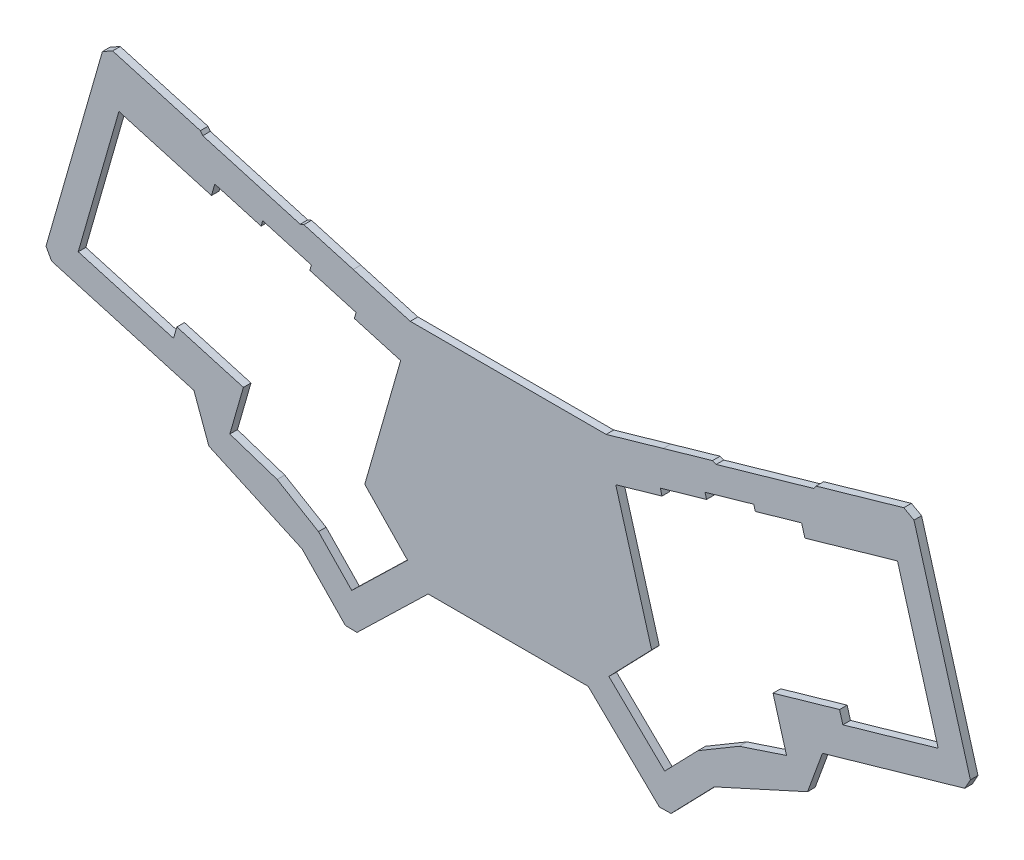
from build123d import *

# Parameters (mm, degrees)
BOSS_EXTRU_1_DEPTH = 3


with BuildPart() as part:
    # Esquisse1 → Boss.-Extru.1 (new body)
    with BuildSketch(Plane.XY):
        Polygon((-113.35310374, -10.173637327), (-129.143746737, -14.701531345), (-206.446773007, -14.701531345), (-222.237416003, -10.173637327), (-228.962816583, -8.245159743), (-248.413999189, -2.668793647), (-249.872259625, -3.248768002), (-288.323340616, 7.774587685), (-289.252816682, 9.039090747), (-323.901077775, 18.972234266), (-327.912092601, 16.748746626), (-350.173506381, -60.88602933), (-347.950273, -64.896848521), (-291.80662177, -80.995781451), (-285.908889082, -97.08692424), (-249.107067355, -113.823629959), (-232.032352152, -131.457901649), (-227.449883961, -131.529994355), (-199.380152195, -104.350948678), (-136.210367548, -104.350948678), (-108.140635782, -131.529994355), (-103.558167591, -131.457901649), (-86.483452388, -113.823629959), (-49.681630661, -97.08692424), (-43.783897973, -80.995781451), (12.359753257, -64.896848521), (14.582986638, -60.88602933), (-7.678427142, 16.748746626), (-11.689441968, 18.972234266), (-46.337703061, 9.039090747), (-47.267179127, 7.774587685), (-85.718260118, -3.248768002), (-87.176520554, -2.668793647), (-106.62770316, -8.245159743), align=None)
        Polygon((-210.232188047, -30.001147656), (-224.390430785, -79.377961929), (-208.212806214, -96.161100182), (-207.491865187, -96.85509979), (-208.236606037, -97.572971364), (-229.533063287, -118.225792128), (-242.655085998, -104.673746846), (-258.969310369, -95.012679745), (-277.629290011, -88.825419148), (-272.289144354, -70.202118055), (-298.538981418, -62.6750984), (-299.849714513, -67.246167925), (-337.461409717, -56.461187875), (-321.404434006, -0.463858857), (-284.873898651, -10.938821309), (-283.564528345, -6.372504389), (-265.299260667, -11.609985616), (-264.679553884, -9.448811229), (-245.452786066, -14.960840928), (-246.072799476, -17.123084647), (-227.807531798, -22.360565873), (-228.496674065, -24.763890567), align=None, mode=Mode.SUBTRACT)
        Polygon((-106.057456456, -118.225792128), (-128.0696158, -96.878899722), (-127.377713529, -96.161100182), (-111.200088958, -79.377961929), (-125.358331696, -30.001147656), (-107.093845678, -24.763890567), (-107.782987945, -22.360565873), (-89.517720268, -17.123084647), (-90.137733677, -14.960840928), (-70.910965859, -9.448811229), (-70.291259076, -11.609985616), (-52.025991399, -6.372504389), (-50.716621092, -10.938821309), (-14.186085737, -0.463858857), (1.870889973, -56.461187875), (-35.740805231, -67.246167925), (-37.051538325, -62.6750984), (-63.301375389, -70.202118055), (-57.961229733, -88.825419148), (-76.621209374, -95.012679745), (-92.935433745, -104.673746846), align=None, mode=Mode.SUBTRACT)
    extrude(amount=BOSS_EXTRU_1_DEPTH)


solid = part.part
